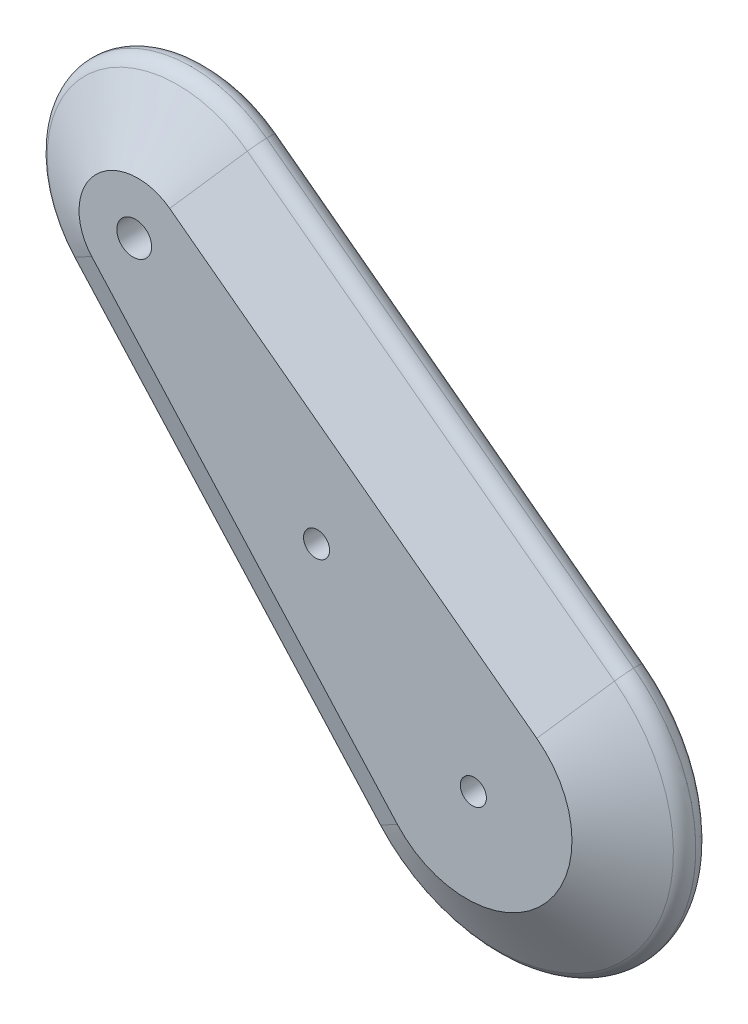
from build123d import *
from OCP.BRepFilletAPI import BRepFilletAPI_MakeChamfer
from build123d.topology import SkipClean

# Parameters (mm, degrees)
SKETCH3_R           = 9.8
BOSS_EXTRUDE1_DEPTH = 5
BOSS_EXTRUDE2_START = -0.5
SKETCH4_R           = 9.8
SKETCH4_R_2         = 2
BOSS_EXTRUDE2_DEPTH = 1.504241
SKETCH5_R           = 2
SKETCH5_R_2         = 1.5
BOSS_EXTRUDE3_DEPTH = 3
CHAMFER1_SIZE       = 1
CHAMFER2_SIZE       = 5
CHAMFER2_SIZE2      = 8.660254038
FILLET2_R           = 2
FILLET3_R           = 0.5
FILLET4_R           = 1


with BuildPart() as part:
    # Sketch3 → Boss-Extrude1 (new body)
    with BuildSketch(Plane(origin=(0.691739192, 0.312135282, 13.787976173), x_dir=(0.9987445115277264, -0.0011337468343132527, -0.05008108736198661), z_dir=(0.05009391872516315, 0.022604009769024314, 0.998488686991054))):
        with BuildLine():
            Line((140.253671157, 144.448714786), (176.290266742, 102.744894421))
            ThreePointArc((176.290266742, 102.744894421), (205.813399011, 101.931737583), (203.955942254, 131.407599188))
            Line((203.955942254, 131.407599188), (161.002927791, 165.945743361))
            ThreePointArc((161.002927791, 165.945743361), (140.810717928, 164.673307049), (140.253671157, 144.448714786))
        make_face()
        with Locations(Location((151.603369143, 154.256077104, 0), (0, 0, 0.064975524))):
            Circle(SKETCH3_R, mode=Mode.SUBTRACT)
        with BuildLine():
            Line((165.483849206, 133.309323792), (182.874627326, 109.561239498))
            ThreePointArc((182.874627326, 109.561239498), (199.216884162, 108.643228405), (196.960479057, 124.854975345))
            Line((196.960479057, 124.854975345), (171.864978729, 140.237645288))
            ThreePointArc((171.864978729, 140.237645288), (165.82582413, 139.397095573), (165.483849206, 133.309323792))
        make_face(mode=Mode.SUBTRACT)
    extrude(amount=BOSS_EXTRUDE1_DEPTH)

    # Sketch4 → Boss-Extrude2 (add)
    with SkipClean():  # the faces are left unmerged after this step: merging them gives an invalid solid
        with BuildSketch(Plane(origin=(0.891902408, 0.402455453, 17.777696121), x_dir=(0.9987445115277264, -0.001133746834313233, -0.050081087361986625), z_dir=(0.05009391872516317, 0.022604009769023947, 0.998488686991054)).offset(BOSS_EXTRUDE2_START)):
            with Locations(Location((151.603369143, 154.256077104, 0), (0, 0, 0.064975524))):
                Circle(SKETCH4_R)
            with Locations(Location((151.603369143, 154.256077104, 0), (0, 0, 0.064975524))):
                Circle(SKETCH4_R_2, mode=Mode.SUBTRACT)
        extrude(amount=BOSS_EXTRUDE2_DEPTH)

    # Sketch5 → Boss-Extrude3 (add)
    with BuildSketch(Plane(origin=(0.942208786, 0.425155331, 18.780419608), x_dir=(0.9987445115277264, -0.0011337468343133737, -0.05008108736198685), z_dir=(0.05009391872516338, 0.022604009769026663, 0.9984886869910538))):
        with BuildLine():
            Line((203.955942254, 131.407599188), (161.002927791, 165.945743361))
            ThreePointArc((161.002927791, 165.945743361), (140.810717928, 164.673307049), (140.253671157, 144.448714786))
            Line((140.253671157, 144.448714786), (176.290266742, 102.744894421))
            ThreePointArc((176.290266742, 102.744894421), (205.813399011, 101.931737583), (203.955942254, 131.407599188))
        make_face()
        with Locations(Location((151.603369143, 154.256077104, 0), (0, 0, 0.064975524))):
            Circle(SKETCH5_R, mode=Mode.SUBTRACT)
        with Locations(Location((191.42319739, 115.821377511, 0), (0, 0, 180.064975524))):
            Circle(SKETCH5_R_2, mode=Mode.SUBTRACT)
        with Locations(Location((173.034279818, 132.757956579, 0), (0, 0, 180.064975524))):
            Circle(SKETCH5_R_2, mode=Mode.SUBTRACT)
    extrude(amount=BOSS_EXTRUDE3_DEPTH)

    # Chamfer1
    chamfer1_edges = [part.edges().sort_by_distance(p)[0] for p in [
        (182.942073388, 148.743838122, 1.284294106),
        (206.246741853, 101.984423156, 1.173655001),
        (158.764999509, 123.6978407, 3.064248519),
        (141.325670887, 164.783618197, 3.009066116),
    ]]
    chamfer(chamfer1_edges, length=CHAMFER1_SIZE)

    # Chamfer2: one chamfer whose edges measure the first distance from different faces: ONE call of the kernel's chamfer builder (chamfer() names one face for all edges)
    chamfer2_edges_1 = [part.edges().sort_by_distance(p)[0] for p in [
        (206.647493203, 102.165255234, 9.161564497),
    ]]
    chamfer2_side_1 = [part.faces().sort_by_distance(p)[0] for p in [
        (206.472164487, 102.0861412, 5.666854092),
    ]]
    chamfer2_edges_2 = [part.edges().sort_by_distance(p)[0] for p in [
        (183.342824738, 148.9246702, 9.272203602),
    ]]
    chamfer2_side_2 = [part.faces().sort_by_distance(p)[0] for p in [
        (183.167496022, 148.845556166, 5.777493198),
    ]]
    chamfer2_edges_3 = [part.edges().sort_by_distance(p)[0] for p in [
        (141.726422237, 164.964450275, 10.996975612),
    ]]
    chamfer2_side_3 = [part.faces().sort_by_distance(p)[0] for p in [
        (141.551093521, 164.88533624, 7.502265207),
    ]]
    chamfer2_edges_4 = [part.edges().sort_by_distance(p)[0] for p in [
        (159.165750859, 123.878672778, 11.052158015),
    ]]
    chamfer2_side_4 = [part.faces().sort_by_distance(p)[0] for p in [
        (158.990422144, 123.799558744, 7.55744761),
    ]]
    chamfer2 = BRepFilletAPI_MakeChamfer(part.part.solid().wrapped)
    for e in chamfer2_edges_1:
        chamfer2.Add(CHAMFER2_SIZE, CHAMFER2_SIZE2, e.wrapped, chamfer2_side_1[0].wrapped)  # the first distance lies on this face
    for e in chamfer2_edges_2:
        chamfer2.Add(CHAMFER2_SIZE, CHAMFER2_SIZE2, e.wrapped, chamfer2_side_2[0].wrapped)  # the first distance lies on this face
    for e in chamfer2_edges_3:
        chamfer2.Add(CHAMFER2_SIZE, CHAMFER2_SIZE2, e.wrapped, chamfer2_side_3[0].wrapped)  # the first distance lies on this face
    for e in chamfer2_edges_4:
        chamfer2.Add(CHAMFER2_SIZE, CHAMFER2_SIZE2, e.wrapped, chamfer2_side_4[0].wrapped)  # the first distance lies on this face
    add(Compound.cast(chamfer2.Shape()), mode=Mode.REPLACE)

    # Fillet2
    fillet2_edges = [part.edges().sort_by_distance(p)[0] for p in [
        (158.815093428, 123.720444709, 4.062737206),
        (206.296835772, 102.007027166, 2.172143688),
        (141.375764806, 164.806222206, 4.007554803),
        (182.992167307, 148.766442132, 2.282782793),
        (158.915281266, 123.765652729, 6.05971458),
        (206.397023609, 102.052235185, 4.169121062),
        (141.475952643, 164.851430226, 6.004532177),
        (183.092355144, 148.811650151, 4.279760167),
    ]]
    fillet(fillet2_edges, radius=FILLET2_R)

    # Fillet3
    fillet3_edges = [part.edges().sort_by_distance(p)[0] for p in [
        (166.559840505, 139.598540375, 7.32078778),
        (174.902767026, 121.631856639, 7.308959115),
        (199.908978446, 108.814693682, 6.344561763),
        (185.123409624, 132.728437076, 6.544985259),
        (142.49219839, 154.435838615, 6.685847049),
    ]]
    fillet(fillet3_edges, radius=FILLET3_R)

    # Fillet4
    fillet4_edges = [part.edges().sort_by_distance(p)[0] for p in [
        (166.309370911, 139.485520326, 2.328344345),
        (174.652297433, 121.518836591, 2.31651568),
        (199.658508853, 108.701673633, 1.352118328),
        (184.87294003, 132.615417028, 1.552541824),
        (142.317082134, 154.356820449, 3.195371445),
    ]]
    fillet(fillet4_edges, radius=FILLET4_R)


solid = part.part
